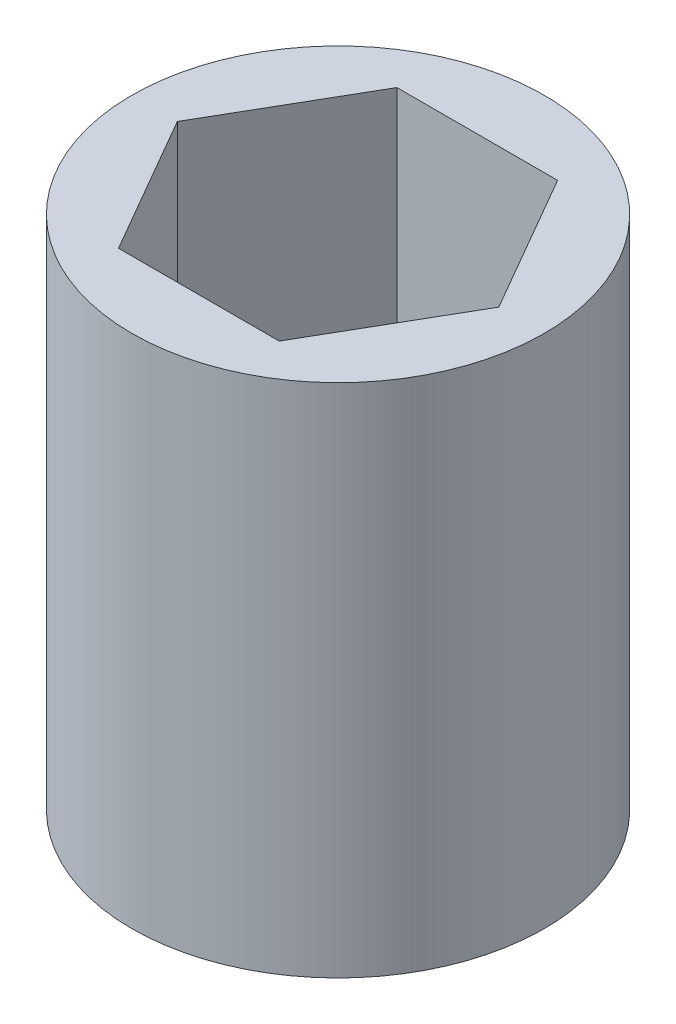
from build123d import *

# Parameters (mm, degrees)
SKETCH1_R           = 10.16
BOSS_EXTRUDE1_DEPTH = 25.4


with BuildPart() as part:
    # Sketch1 → Boss-Extrude1 (new body)
    with BuildSketch(Plane(origin=(0, 0, 0), x_dir=(1, 0, 0), z_dir=(0, 1, 0))):
        with Locations(Location((0, 0, 0), (0, 0, 270))):
            Circle(SKETCH1_R)
        Polygon((7.918936292, 0), (3.959468146, 6.858), (-3.959468146, 6.858), (-7.918936292, 0), (-3.959468146, -6.858), (3.959468146, -6.858), align=None, mode=Mode.SUBTRACT)
    extrude(amount=BOSS_EXTRUDE1_DEPTH)


solid = part.part
